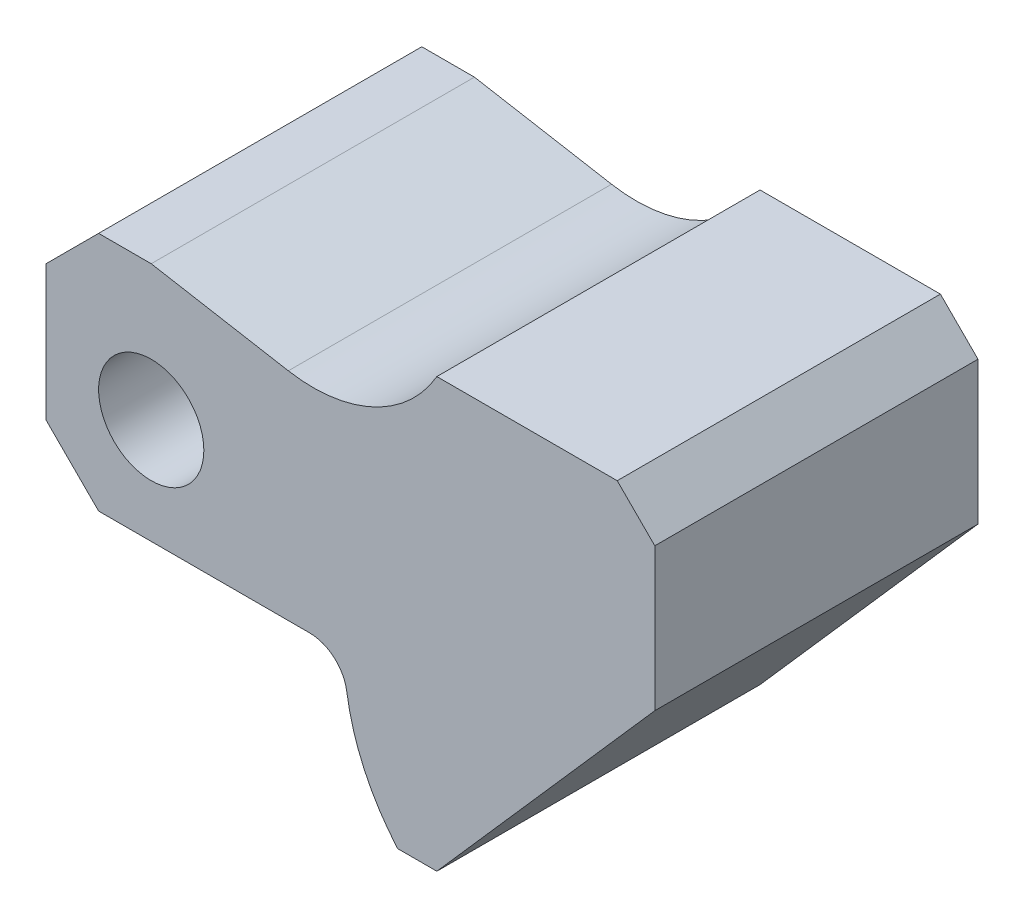
from build123d import *

# Parameters (mm, degrees)
SKETCH1_R           = 7
BOSS_EXTRUDE1_DEPTH = 21.5


with BuildPart() as part:
    # Sketch1 → Boss-Extrude1 (new, symmetric)
    with BuildSketch(Plane.XY):
        with BuildLine():
            Line((0, 0), (-7, 7))
            Line((-7, 7), (-7, 25))
            Line((-7, 25), (0, 32))
            Line((0, 32), (7, 32))
            Line((7, 32), (25.243084988, 28.783251905))
            ThreePointArc((25.243084988, 28.783251905), (36.574972961, 30.276069151), (45, 38))
            Line((45, 38), (69, 38))
            Line((69, 38), (74, 33))
            Line((74, 33), (74, 14))
            Line((74, 14), (45, -19))
            Line((45, -19), (39.788067397, -19))
            ThreePointArc((39.788067397, -19), (35.3490952, -12.115672061), (33.012264997, -4.264705882))
            ThreePointArc((33.012264997, -4.264705882), (31.331862036, -1.213413768), (28.066626255, 0))
            Line((28.066626255, 0), (0, 0))
        make_face()
        with Locations((7, 14)):
            Circle(SKETCH1_R, mode=Mode.SUBTRACT)
    extrude(amount=BOSS_EXTRUDE1_DEPTH, both=True)


solid = part.part
